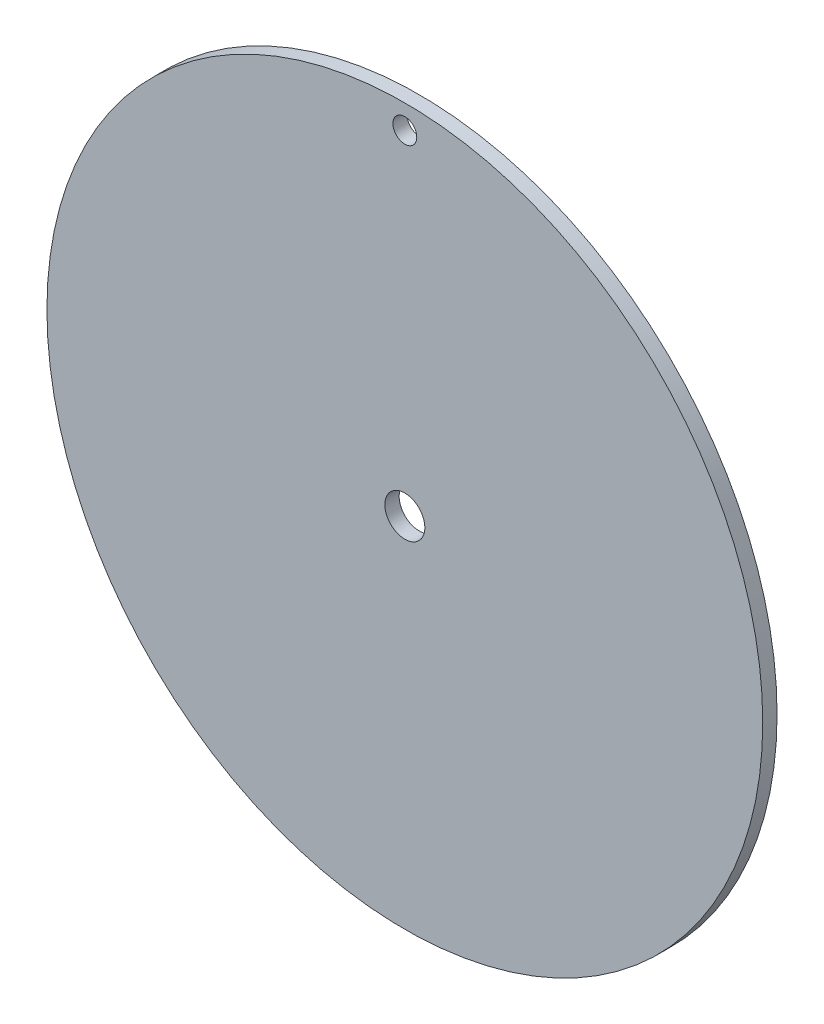
from build123d import *

# Parameters (mm, degrees)
SKETCH1_R           = 75
SKETCH1_R_2         = 2.5
BOSS_EXTRUDE1_DEPTH = 3
SKETCH2_R           = 4.19
CUT_EXTRUDE1_DEPTH  = 107.108435103


with BuildPart() as part:
    # Sketch1 → Boss-Extrude1 (new body)
    with BuildSketch(Plane.XY):
        Circle(SKETCH1_R)
        with Locations((0, 70)):
            Circle(SKETCH1_R_2, mode=Mode.SUBTRACT)
    extrude(amount=BOSS_EXTRUDE1_DEPTH)

    # Sketch2 → Cut-Extrude1 (cut, through all)
    with BuildSketch(Plane.XY.offset(3)):
        Circle(SKETCH2_R)
    extrude(amount=-CUT_EXTRUDE1_DEPTH, mode=Mode.SUBTRACT)


solid = part.part
